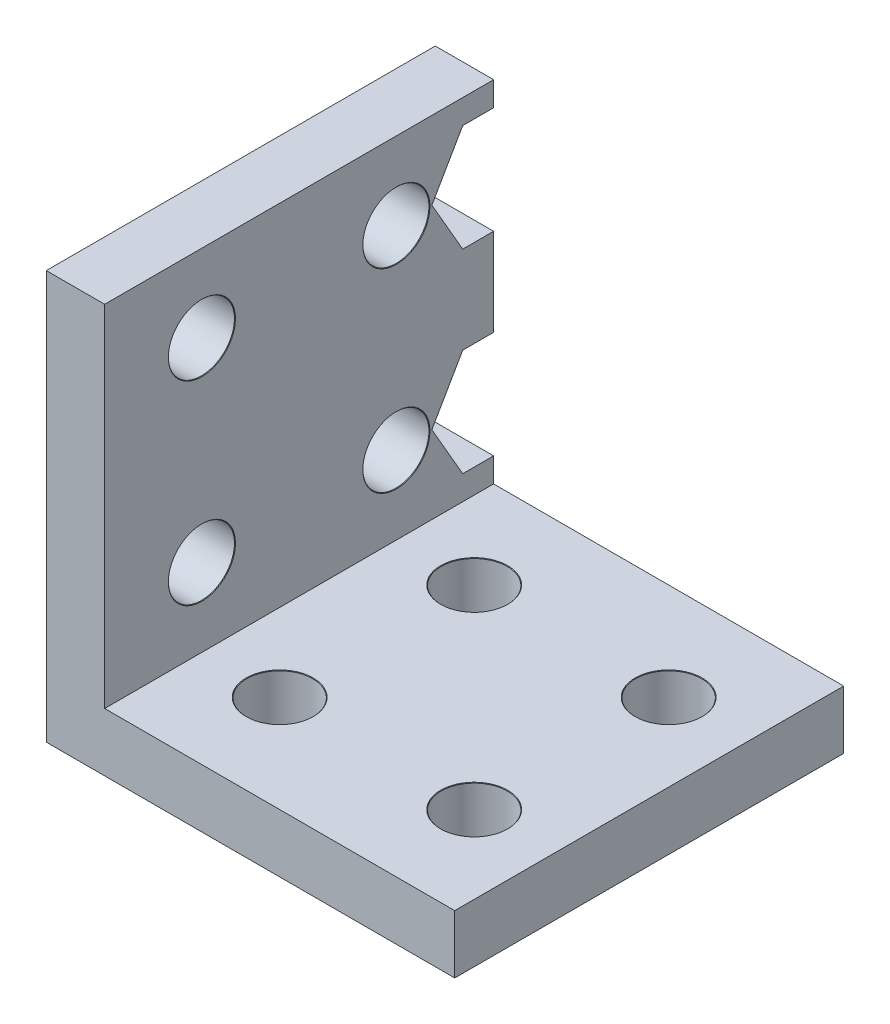
from build123d import *

# Parameters (mm, degrees)
BOSS_EXTRUDE1_DEPTH            = 20
M3_CLEARANCE_HOLE1_D           = 3.4
M3_CLEARANCE_HOLE1_CSINK_D     = 3.45
M3_CLEARANCE_HOLE1_CSINK_ANGLE = 90
M3_CLEARANCE_HOLE2_D           = 3.4
M3_CLEARANCE_HOLE2_CSINK_D     = 3.45
M3_CLEARANCE_HOLE2_CSINK_ANGLE = 90
CUT_EXTRUDE1_DEPTH             = 3


with BuildPart() as part:
    # Sketch1 → Boss-Extrude1 (new body)
    with BuildSketch(Plane.XY):
        Polygon((0, 21), (0, 0), (21, 0), (21, 3), (3, 3), (3, 21), align=None)
    extrude(amount=BOSS_EXTRUDE1_DEPTH)

    # M3 Clearance Hole1 (through all)
    with Locations(Plane(origin=(0, 3, 0), x_dir=(1, 0, 0), z_dir=(0, 1, 0))):
        with Locations((7, -15), (7, -5), (17, -5), (17, -15)):
            CounterSinkHole(M3_CLEARANCE_HOLE1_D / 2, M3_CLEARANCE_HOLE1_CSINK_D / 2, counter_sink_angle=M3_CLEARANCE_HOLE1_CSINK_ANGLE)

    # M3 Clearance Hole2 (through all)
    with Locations(Plane(origin=(3, 0, 0), x_dir=(0, 0, -1), z_dir=(1, 0, 0))):
        with Locations((-15, 7), (-5, 7), (-5, 17), (-15, 17)):
            CounterSinkHole(M3_CLEARANCE_HOLE2_D / 2, M3_CLEARANCE_HOLE2_CSINK_D / 2, counter_sink_angle=M3_CLEARANCE_HOLE2_CSINK_ANGLE)

    # Sketch6 → Cut-Extrude1 (cut)
    with BuildSketch(Plane(origin=(3, 0, 0), x_dir=(0, 0, -1), z_dir=(1, 0, 0))):
        Polygon((0, 9.75), (-1.58771324, 9.75), (-3.175426481, 7), (-1.58771324, 4.25), (0, 4.25), align=None)
        Polygon((-1.58771324, 14.25), (0, 14.25), (0, 19.75), (-1.58771324, 19.75), (-3.175426481, 17), align=None)
    extrude(amount=-CUT_EXTRUDE1_DEPTH, mode=Mode.SUBTRACT)


solid = part.part
